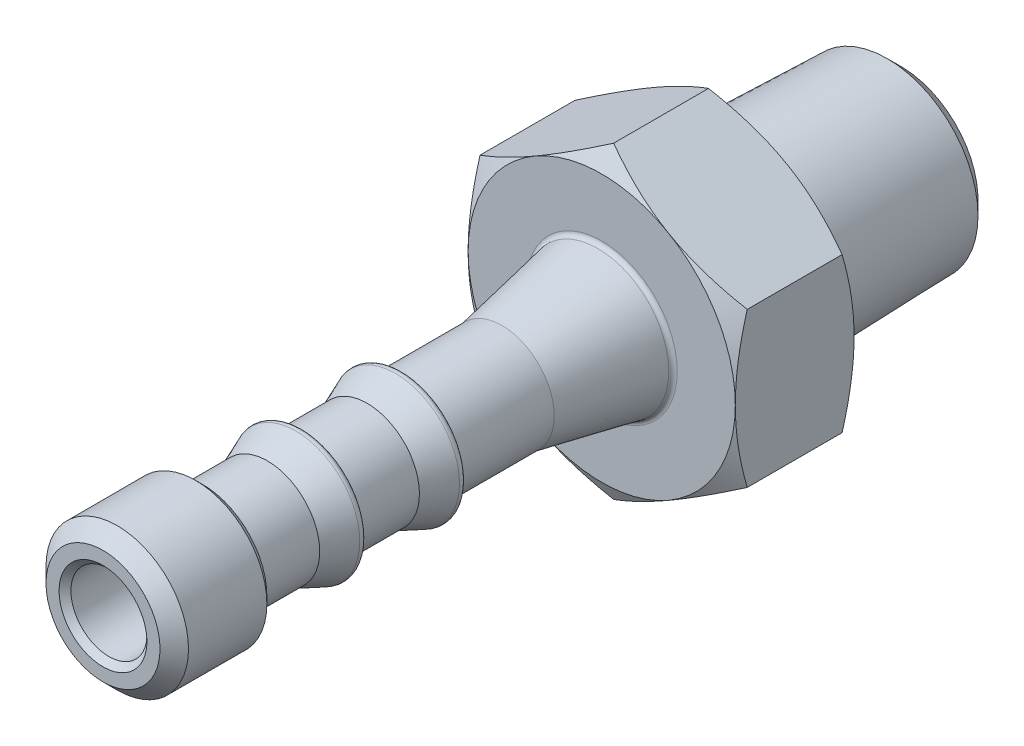
from build123d import *

# Parameters (mm, degrees)
CHAMFER1_SIZE       = 0.381
CHAMFER2_SIZE       = 0.762
SKETCH3_R           = 4.833177772
BOSS_EXTRUDE1_DEPTH = 9.652
BOSS_EXTRUDE1_DRAFT = -1.78333333
SKETCH6_OUTSIDE_W   = 40.586
SKETCH6_OUTSIDE_H   = 40.586
SKETCH6_OUTSIDE_R   = 4.120310565
CUT_EXTRUDE1_DEPTH  = 9.652
CUT_EXTRUDE1_DRAFT  = -45
BOSS_EXTRUDE2_DEPTH = 6.35
SKETCH8_OUTSIDE_W   = 47.87
SKETCH8_OUTSIDE_H   = 50.08
SKETCH8_OUTSIDE_R   = 7.14375
CUT_EXTRUDE2_DEPTH  = 6.35
CUT_EXTRUDE2_DRAFT  = -60
SKETCH9_OUTSIDE_W   = 47.87
SKETCH9_OUTSIDE_H   = 50.08
SKETCH9_OUTSIDE_R   = 7.14375
CUT_EXTRUDE3_DEPTH  = 6.35
CUT_EXTRUDE3_DRAFT  = -60
SKETCH10_W          = 33.02
SKETCH10_H          = 2.032
CHAMFER3_SIZE       = 0.3175
CHAMFER4_SIZE       = 0.508


with BuildPart() as part:
    # Sketch2 → Revolve1 (revolve)
    with BuildSketch(Plane(origin=(0, 0, 0), x_dir=(0, 0, -1), z_dir=(1, 0, 0)), mode=Mode.PRIVATE) as revolve1_sk:
        with BuildLine():
            Line((-21.082, 2.794), (-17.87705275, 2.794))
            Line((-17.87705275, 2.794), (-16.351150075, 3.410504699))
            ThreePointArc((-16.351150075, 3.410504699), (-16.113965003, 3.385575543), (-16.002, 3.175))
            Line((-16.002, 3.175), (-16.002, 3.048))
            ThreePointArc((-16.002, 3.048), (-15.927605122, 2.868394878), (-15.748, 2.794))
            Line((-15.748, 2.794), (-12.54305275, 2.794))
            Line((-12.54305275, 2.794), (-11.017150075, 3.410504699))
            ThreePointArc((-11.017150075, 3.410504699), (-10.779965003, 3.385575543), (-10.668, 3.175))
            Line((-10.668, 3.175), (-10.668, 3.048))
            ThreePointArc((-10.668, 3.048), (-10.593605122, 2.868394878), (-10.414, 2.794))
            Line((-10.414, 2.794), (-5.334, 2.794))
            Line((-5.334, 2.794), (-0.205534515, 3.790872706))
            ThreePointArc((-0.205534515, 3.790872706), (-0.058007356, 3.878642143), (0, 4.040206011))
            Line((0, 4.040206011), (0, 0))
            Line((0, 0), (-26.67, 0))
            Line((-26.67, 0), (-26.67, 3.81))
            Line((-26.67, 3.81), (-21.336, 3.81))
            Line((-21.336, 3.81), (-21.336, 3.048))
            ThreePointArc((-21.336, 3.048), (-21.261605122, 2.868394878), (-21.082, 2.794))
        make_face()
    revolve(revolve1_sk.sketch.rotate(Axis((0, 0, 26.67), (0, 0, -1)), 90), axis=Axis((0, 0, 26.67), (0, 0, -1)))

    # Chamfer1
    chamfer1_edges = [part.edges().sort_by_distance(p)[0] for p in [
        (-3.81, 0, 21.336),
    ]]
    chamfer(chamfer1_edges, length=CHAMFER1_SIZE)

    # Chamfer2
    chamfer2_edges = [part.edges().sort_by_distance(p)[0] for p in [
        (-3.81, 0, 26.67),
    ]]
    chamfer(chamfer2_edges, length=CHAMFER2_SIZE)



with BuildPart() as body_2:
    # Sketch3 → Boss-Extrude1 (with draft: the straight prism first)
    with BuildSketch(Plane.XY.offset(-16.002)):
        Circle(SKETCH3_R)
    extrude(amount=BOSS_EXTRUDE1_DEPTH)
    # Boss-Extrude1: the draft: its side faces are tilted about the plane it starts from
    boss_extrude1_sides = [body_2.faces().sort_by_distance(p)[0] for p in [
        (-4.833177772, 0, -11.176),
    ]]
    draft(boss_extrude1_sides, Plane.XY.offset(-16.002), BOSS_EXTRUDE1_DRAFT)


with BuildPart() as cut_extrude1_tool:
    # Sketch6 outside → Cut-Extrude1 (with draft: the straight prism first)
    with BuildSketch(Plane(origin=(0, 0, -16.002), x_dir=(-1, 0, 0), z_dir=(0, 0, -1))):
        Rectangle(SKETCH6_OUTSIDE_W, SKETCH6_OUTSIDE_H)
        Circle(SKETCH6_OUTSIDE_R, mode=Mode.SUBTRACT)
    extrude(amount=-CUT_EXTRUDE1_DEPTH)
    # Cut-Extrude1: the draft: its side faces are tilted about the plane it starts from
    cut_extrude1_sides = [cut_extrude1_tool.faces().sort_by_distance(p)[0] for p in [
        (0, -20.293, -11.176),
        (-20.293, 0, -11.176),
        (0, 20.293, -11.176),
        (20.293, 0, -11.176),
        (4.120310565, 0, -11.176),
    ]]
    draft(cut_extrude1_sides, Plane(origin=(0, 0, -16.002), x_dir=(-1, 0, 0), z_dir=(0, 0, -1)), CUT_EXTRUDE1_DRAFT)


with BuildPart() as body_2_1:
    add(body_2.part)

    # Cut-Extrude1: cut by cut_extrude1_tool
    add(cut_extrude1_tool.part, mode=Mode.SUBTRACT)


with BuildPart() as part_1:
    add(part.part)

    add(body_2_1.part)  # Boss-Extrude2 merges body 2
    # Sketch7 → Boss-Extrude2 (add)
    with BuildSketch(Plane(origin=(0, 0, 0), x_dir=(-1, 0, 0), z_dir=(0, 0, -1))):
        Polygon((0, 8.248891971), (-7.14375, 4.124445986), (-7.14375, -4.124445986), (0, -8.248891971), (7.14375, -4.124445986), (7.14375, 4.124445986), align=None)
    extrude(amount=BOSS_EXTRUDE2_DEPTH)


with BuildPart() as cut_extrude2_tool:
    # Sketch8 outside → Cut-Extrude2 (with draft: the straight prism first)
    with BuildSketch(Plane.XY):
        Rectangle(SKETCH8_OUTSIDE_W, SKETCH8_OUTSIDE_H)
        Circle(SKETCH8_OUTSIDE_R, mode=Mode.SUBTRACT)
    extrude(amount=-CUT_EXTRUDE2_DEPTH)
    # Cut-Extrude2: the draft: its side faces are tilted about the plane it starts from
    cut_extrude2_sides = [cut_extrude2_tool.faces().sort_by_distance(p)[0] for p in [
        (0, -25.04, -3.175),
        (23.935, 0, -3.175),
        (0, 25.04, -3.175),
        (-23.935, 0, -3.175),
        (-7.14375, 0, -3.175),
    ]]
    draft(cut_extrude2_sides, Plane.XY, CUT_EXTRUDE2_DRAFT)


with BuildPart() as part_2:
    add(part_1.part)

    # Cut-Extrude2: cut by cut_extrude2_tool
    add(cut_extrude2_tool.part, mode=Mode.SUBTRACT)


with BuildPart() as cut_extrude3_tool:
    # Sketch9 outside → Cut-Extrude3 (with draft: the straight prism first)
    with BuildSketch(Plane(origin=(0, 0, -6.35), x_dir=(-1, 0, 0), z_dir=(0, 0, -1))):
        Rectangle(SKETCH9_OUTSIDE_W, SKETCH9_OUTSIDE_H)
        Circle(SKETCH9_OUTSIDE_R, mode=Mode.SUBTRACT)
    extrude(amount=-CUT_EXTRUDE3_DEPTH)
    # Cut-Extrude3: the draft: its side faces are tilted about the plane it starts from
    cut_extrude3_sides = [cut_extrude3_tool.faces().sort_by_distance(p)[0] for p in [
        (0, -25.04, -3.175),
        (-23.935, 0, -3.175),
        (0, 25.04, -3.175),
        (23.935, 0, -3.175),
        (7.14375, 0, -3.175),
    ]]
    draft(cut_extrude3_sides, Plane(origin=(0, 0, -6.35), x_dir=(-1, 0, 0), z_dir=(0, 0, -1)), CUT_EXTRUDE3_DRAFT)


with BuildPart() as part_3:
    add(part_2.part)

    # Cut-Extrude3: cut by cut_extrude3_tool
    add(cut_extrude3_tool.part, mode=Mode.SUBTRACT)

    # Sketch10 → Cut-Revolve1 (revolve, cut)
    with BuildSketch(Plane(origin=(0, 0, 0), x_dir=(0, 0, -1), z_dir=(1, 0, 0)), mode=Mode.PRIVATE) as cut_revolve1_sk:
        with Locations((-10.16, 1.016)):
            Rectangle(SKETCH10_W, SKETCH10_H)
    revolve(cut_revolve1_sk.sketch.rotate(Axis((0, 0, 0), (0, 0, 1)), 90), axis=Axis((0, 0, 0), (0, 0, 1)), mode=Mode.SUBTRACT)

    # Chamfer3
    chamfer3_edges = [part_3.edges().sort_by_distance(p)[0] for p in [
        (2.032, 0, 26.67),
    ]]
    chamfer(chamfer3_edges, length=CHAMFER3_SIZE)

    # Sketch11 → Cut-Revolve2 (revolve, cut)
    with BuildSketch(Plane(origin=(0, 0, 0), x_dir=(0, 0, -1), z_dir=(1, 0, 0)), mode=Mode.PRIVATE) as cut_revolve2_sk:
        Polygon((16.002, 0), (16.002, 3.175), (6.35, 3.175), (4.442267535, 0), align=None)
    revolve(cut_revolve2_sk.sketch.rotate(Axis((0, 0, 0), (0, 0, -1)), 270), axis=Axis((0, 0, 0), (0, 0, -1)), mode=Mode.SUBTRACT)

    # Chamfer4
    chamfer4_edges = [part_3.edges().sort_by_distance(p)[0] for p in [
        (3.175, 0, -16.002),
    ]]
    chamfer(chamfer4_edges, length=CHAMFER4_SIZE)


solid = part_3.part
